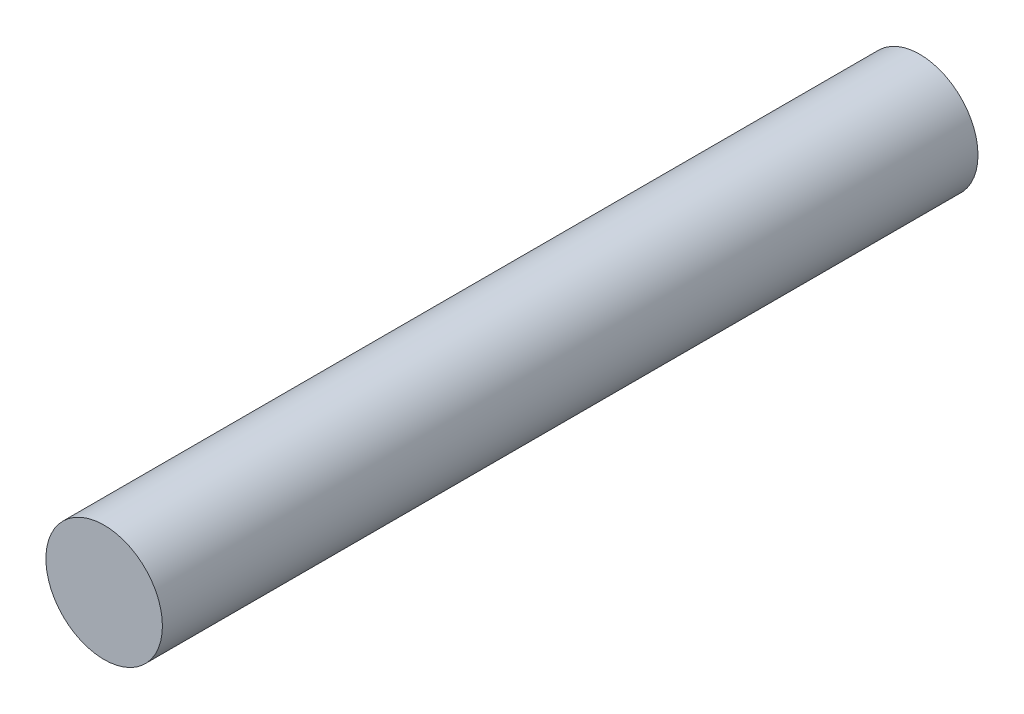
from build123d import *

# Parameters (mm, degrees)
SKETCH1_R           = 3.175
BOSS_EXTRUDE1_DEPTH = 22.225


with BuildPart() as part:
    # Sketch1 → Boss-Extrude1 (new, symmetric)
    with BuildSketch(Plane.XY):
        Circle(SKETCH1_R)
    extrude(amount=BOSS_EXTRUDE1_DEPTH, both=True)


solid = part.part
